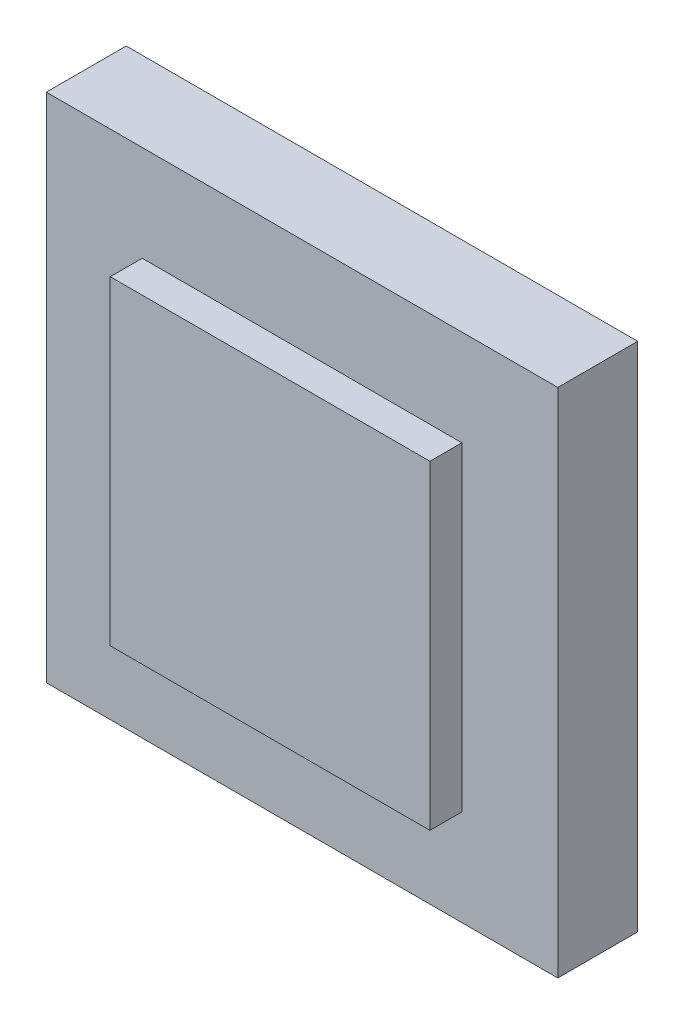
from build123d import *

# Parameters (mm, degrees)
SKETCH2_W           = 406.4
SKETCH2_H           = 406.4
BOSS_EXTRUDE1_DEPTH = 63.5
SKETCH3_W           = 254
SKETCH3_H           = 254
BOSS_EXTRUDE2_DEPTH = 25.4


with BuildPart() as part:
    # Sketch2 → Boss-Extrude1 (new body)
    with BuildSketch(Plane.XY):
        Rectangle(SKETCH2_W, SKETCH2_H)
    extrude(amount=BOSS_EXTRUDE1_DEPTH)

    # Sketch3 → Boss-Extrude2 (add)
    with BuildSketch(Plane.XY.offset(63.5)):
        Rectangle(SKETCH3_W, SKETCH3_H)
    extrude(amount=BOSS_EXTRUDE2_DEPTH)


solid = part.part
